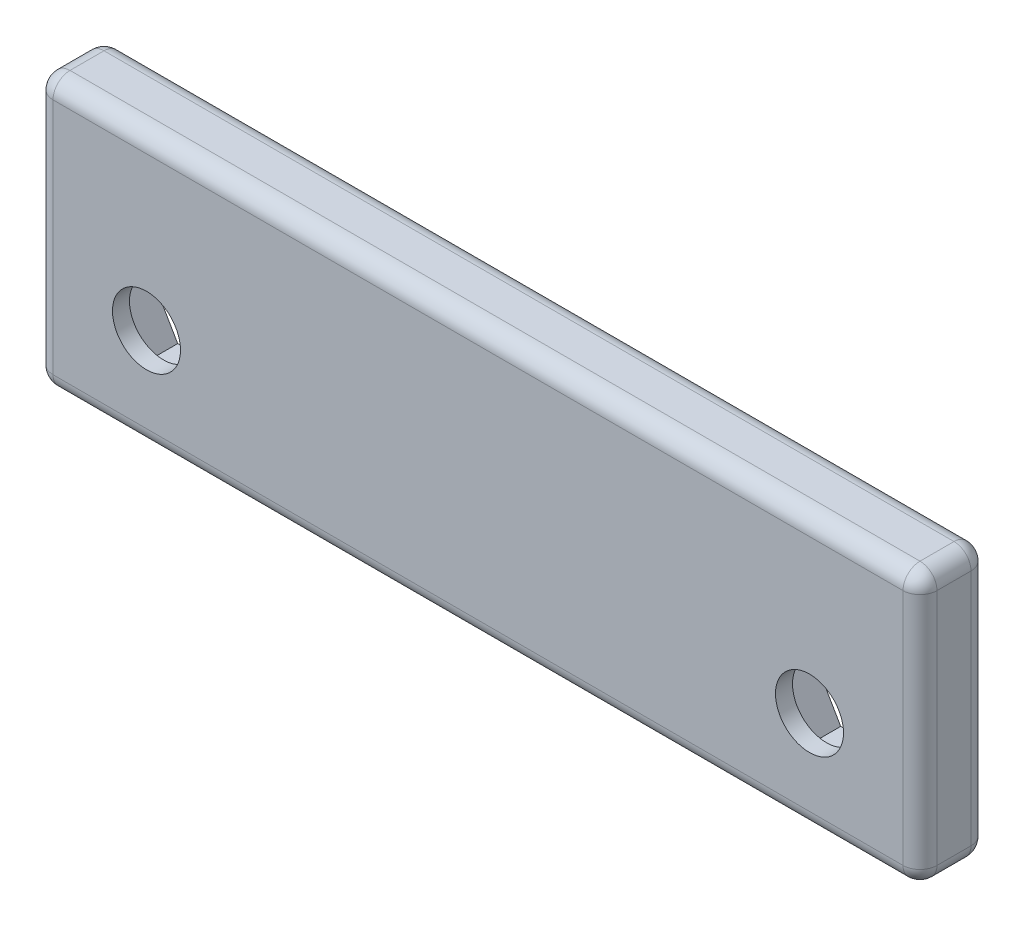
from build123d import *

# Parameters (mm, degrees)
SKETCH1_W           = 52
SKETCH1_H           = 16
SKETCH1_R           = 2
BOSS_EXTRUDE1_DEPTH = 4
FILLET1_R           = 1
CUT_EXTRUDE1_DEPTH  = 3


with BuildPart() as part:
    # Sketch1 → Boss-Extrude1 (new body)
    with BuildSketch(Plane.XY):
        with Locations((13.855253101, 1.7017189)):
            Rectangle(SKETCH1_W, SKETCH1_H)
        with Locations((-5.644746899, -0.2982811)):
            Circle(SKETCH1_R, mode=Mode.SUBTRACT)
        with Locations((33.355253101, -0.2982811)):
            Circle(SKETCH1_R, mode=Mode.SUBTRACT)
    extrude(amount=BOSS_EXTRUDE1_DEPTH)

    # Fillet1
    fillet1_edges = [part.edges().sort_by_distance(p)[0] for p in [
        (39.855253101, 1.7017189, 4),
        (13.855253101, 9.7017189, 4),
        (-12.144746899, 1.7017189, 4),
        (13.855253101, 9.7017189, 0),
        (39.855253101, 1.7017189, 0),
        (13.855253101, -6.2982811, 0),
        (-12.144746899, 1.7017189, 0),
        (13.855253101, -6.2982811, 4),
        (-12.144746899, 9.7017189, 2),
        (39.855253101, 9.7017189, 2),
        (39.855253101, -6.2982811, 2),
        (-12.144746899, -6.2982811, 2),
    ]]
    fillet(fillet1_edges, radius=FILLET1_R)

    # Sketch5 → Cut-Extrude1 (cut)
    with BuildSketch(Plane(origin=(0, 0, 0), x_dir=(-1, 0, 0), z_dir=(0, 0, -1))):
        Polygon((-29.025126082, -0.2982811), (-31.190189592, 3.4517189), (-35.520316611, 3.4517189), (-37.68538012, -0.2982811), (-35.520316611, -4.0482811), (-31.190189592, -4.0482811), align=None)
        Polygon((1.31461988, -0.2982811), (3.479683389, -4.0482811), (7.809810408, -4.0482811), (9.974873918, -0.2982811), (7.809810408, 3.4517189), (3.479683389, 3.4517189), align=None)
    extrude(amount=-CUT_EXTRUDE1_DEPTH, mode=Mode.SUBTRACT)


solid = part.part
